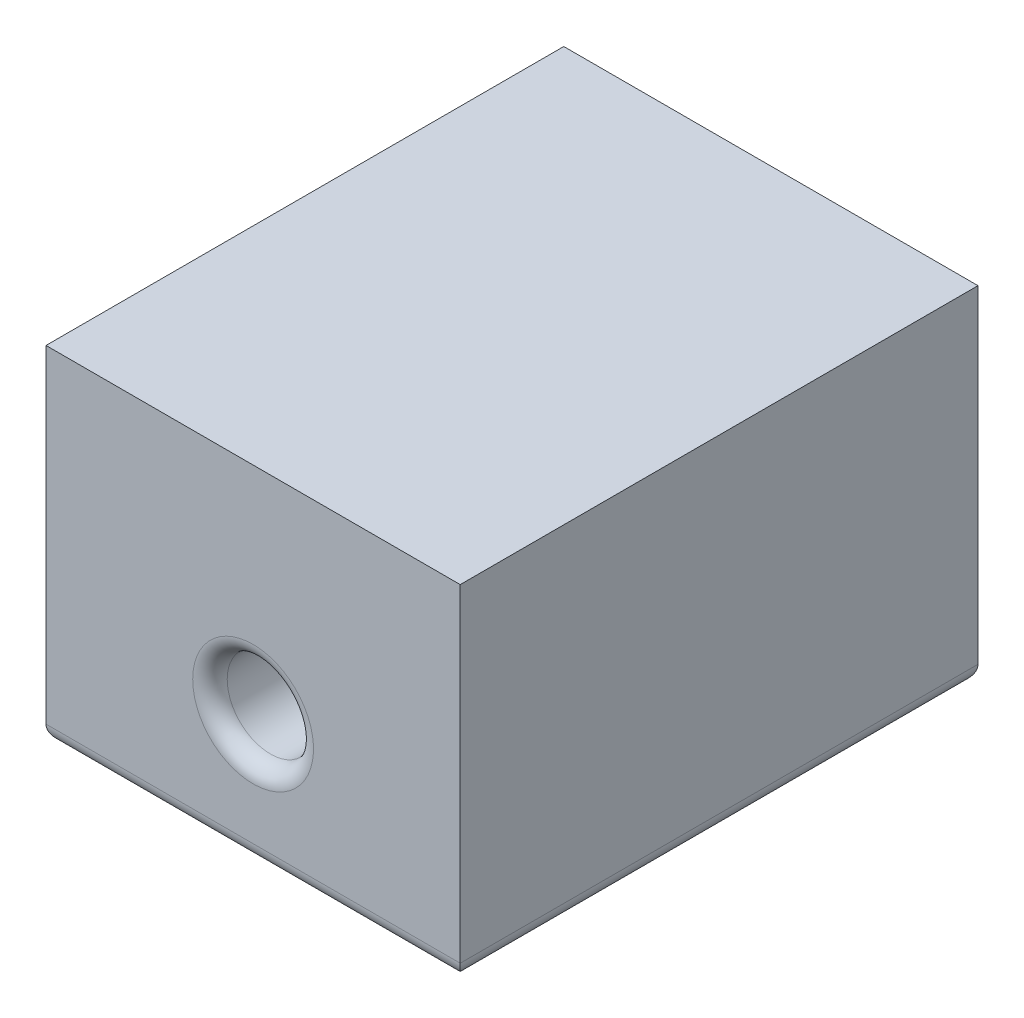
from build123d import *

# Parameters (mm, degrees)
SKETCH1_W               = 24
SKETCH1_H               = 30
BOSS_EXTRUDE1_DEPTH     = 20
CUT_EXTRUDE1_DEPTH      = 44.312815655
CUT_EXTRUDE1_DEPTH_BACK = 44.312815655
SKETCH2_R               = 2.5
FILLET1_R               = 1


with BuildPart() as part:
    # Sketch1 → Boss-Extrude1 (new body)
    with BuildSketch(Plane(origin=(0, 0, 0), x_dir=(1, 0, 0), z_dir=(0, 1, 0))):
        with Locations((12, 15)):
            Rectangle(SKETCH1_W, SKETCH1_H)
    extrude(amount=BOSS_EXTRUDE1_DEPTH)

    # Sketch2 → Cut-Extrude1 (cut, two sides: drawn at the far end of the back side and taken through both)
    with BuildSketch(Plane(origin=(0, 0, -30), x_dir=(-1, 0, 0), z_dir=(0, 0, -1)).offset(-CUT_EXTRUDE1_DEPTH_BACK)):
        with Locations((-12, 7.5)):
            Circle(SKETCH2_R)
    extrude(amount=CUT_EXTRUDE1_DEPTH + CUT_EXTRUDE1_DEPTH_BACK, mode=Mode.SUBTRACT)

    # Fillet1
    fillet1_edges = [part.edges().sort_by_distance(p)[0] for p in [
        (14.5, 7.5, -30),
        (14.5, 7.5, 0),
        (12, 0, 0),
        (24, 0, -15),
        (12, 0, -30),
        (0, 0, -15),
    ]]
    fillet(fillet1_edges, radius=FILLET1_R)


solid = part.part
